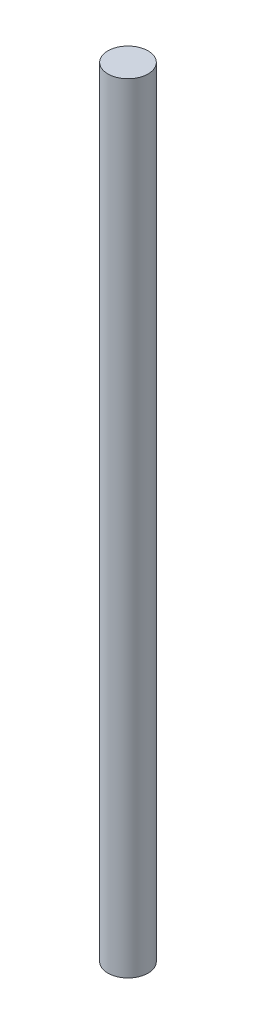
from build123d import *

# Parameters (mm, degrees)
SKETCH1_R           = 6.75
BOSS_EXTRUDE1_DEPTH = 262


with BuildPart() as part:
    # Sketch1 → Boss-Extrude1 (new body)
    with BuildSketch(Plane(origin=(0, 0, 0), x_dir=(1, 0, 0), z_dir=(0, 1, 0))):
        with Locations(Location((0, 0, 0), (0, 0, 270))):
            Circle(SKETCH1_R)
    extrude(amount=BOSS_EXTRUDE1_DEPTH)


solid = part.part
